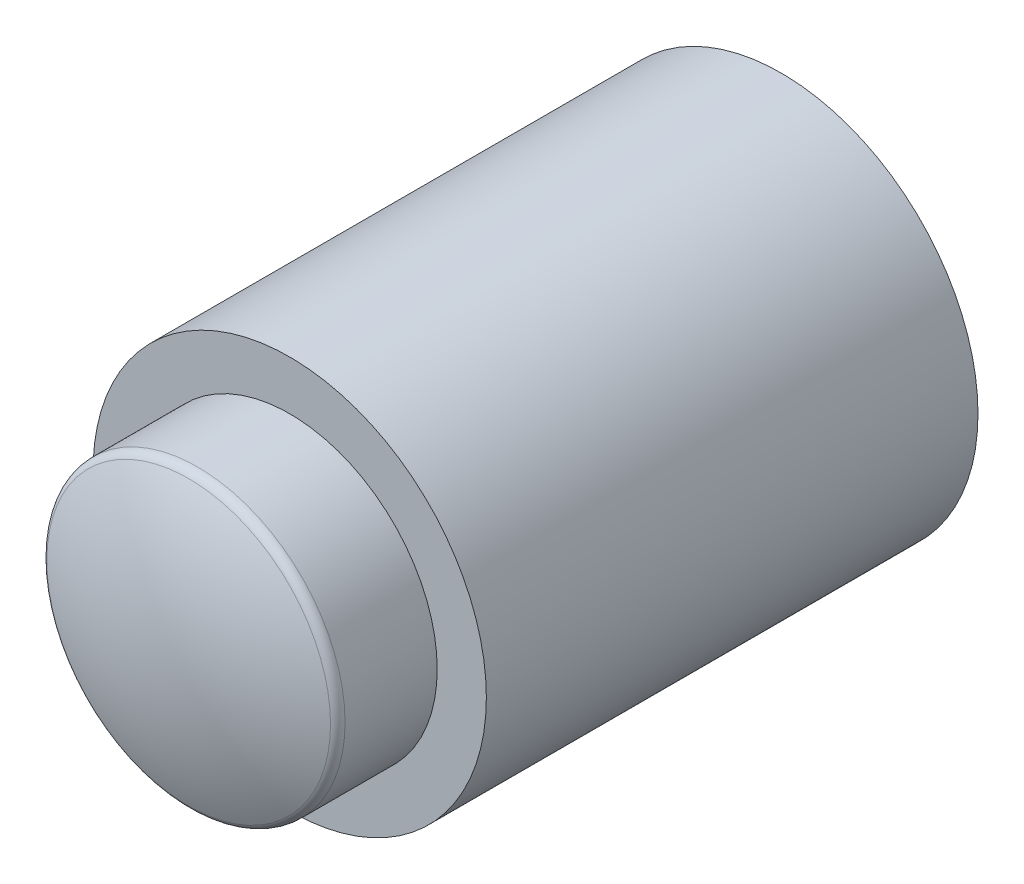
from build123d import *

# Parameters (mm, degrees)
SKETCH1_R           = 30
BOSS_EXTRUDE1_DEPTH = 20
DOME1_FACE_RADIUS   = 30
DOME1_HEIGHT        = 7
SKETCH2_R           = 40
BOSS_EXTRUDE2_DEPTH = 100
FILLET1_R           = 2


with BuildPart() as part:
    # Sketch1 → Boss-Extrude1 (new body)
    with BuildSketch(Plane.XY):
        Circle(SKETCH1_R)
    extrude(amount=BOSS_EXTRUDE1_DEPTH)

    # Dome1: a dome of height H over a round flat face of radius A is a cap of a sphere of radius (A * A + H * H) / (2 * H)
    dome1_r = (DOME1_FACE_RADIUS * DOME1_FACE_RADIUS + DOME1_HEIGHT * DOME1_HEIGHT) / (2 * DOME1_HEIGHT)
    dome1_base = Plane((0, 0, 20), z_dir=(0, 0, 1))
    with Locations(dome1_base.offset(DOME1_HEIGHT - dome1_r)):
        dome1_ball = Sphere(dome1_r, mode=Mode.PRIVATE)
    add(split(dome1_ball, bisect_by=dome1_base, keep=Keep.TOP, mode=Mode.PRIVATE))

    # Sketch2 → Boss-Extrude2 (add)
    with BuildSketch(Plane(origin=(0, 0, 0), x_dir=(-1, 0, 0), z_dir=(0, 0, -1))):
        with Locations(Location((0, 0, 0), (0, 0, 180))):
            Circle(SKETCH2_R)
    extrude(amount=BOSS_EXTRUDE2_DEPTH)

    # Fillet1
    fillet1_edges = [part.edges().sort_by_distance(p)[0] for p in [
        (-30, 0, 20),
    ]]
    fillet(fillet1_edges, radius=FILLET1_R)


solid = part.part
